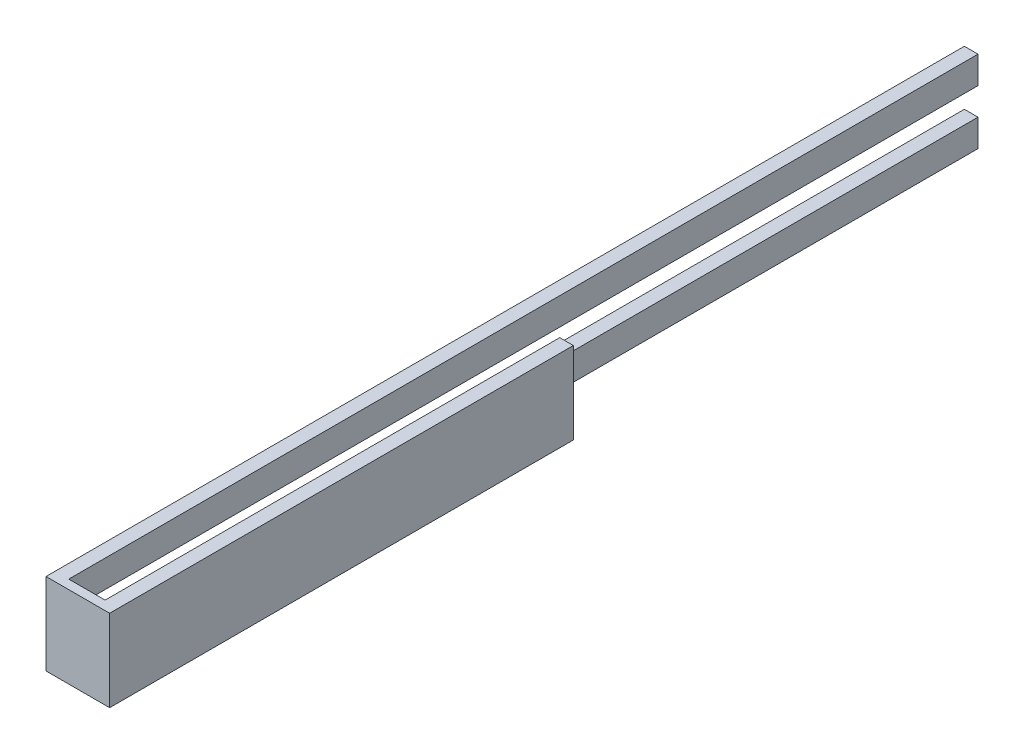
from build123d import *

# Parameters (mm, degrees)
SKETCH1_W           = 6
SKETCH1_H           = 9
BOSS_EXTRUDE1_DEPTH = 1
SKETCH2_W           = 1
SKETCH2_H           = 3
BOSS_EXTRUDE2_DEPTH = 100
SKETCH3_W           = 1
SKETCH3_H           = 9
BOSS_EXTRUDE3_DEPTH = 50
SKETCH4_W           = 51
SKETCH4_H           = 9
BOSS_EXTRUDE4_DEPTH = 0.5
BOSS_EXTRUDE5_DEPTH = 0.5


with BuildPart() as part:
    # Sketch1 → Boss-Extrude1 (new body)
    with BuildSketch(Plane.XY):
        with Locations((3, 4.5)):
            Rectangle(SKETCH1_W, SKETCH1_H)
    extrude(amount=BOSS_EXTRUDE1_DEPTH)

    # Sketch2 → Boss-Extrude2 (add)
    with BuildSketch(Plane(origin=(0, 0, 0), x_dir=(-1, 0, 0), z_dir=(0, 0, -1))):
        with Locations((-0.5, 1.5)):
            Rectangle(SKETCH2_W, SKETCH2_H)
        with Locations((-0.5, 7.5)):
            Rectangle(SKETCH2_W, SKETCH2_H)
    extrude(amount=BOSS_EXTRUDE2_DEPTH)

    # Sketch3 → Boss-Extrude3 (add)
    with BuildSketch(Plane(origin=(0, 0, 0), x_dir=(-1, 0, 0), z_dir=(0, 0, -1))):
        with Locations((-5.5, 4.5)):
            Rectangle(SKETCH3_W, SKETCH3_H)
    extrude(amount=BOSS_EXTRUDE3_DEPTH)

    # Sketch4 → Boss-Extrude4 (add)
    with BuildSketch(Plane(origin=(6, 0, 0), x_dir=(0, 0, -1), z_dir=(1, 0, 0))):
        with Locations((24.5, 4.5)):
            Rectangle(SKETCH4_W, SKETCH4_H)
    extrude(amount=BOSS_EXTRUDE4_DEPTH)

    # Sketch5 → Boss-Extrude5 (add)
    with BuildSketch(Plane.ZY):
        Polygon((1, 9), (-100, 9), (-100, 6), (0, 6), (0, 3), (-100, 3), (-100, 0), (1, 0), align=None)
    extrude(amount=BOSS_EXTRUDE5_DEPTH)


solid = part.part
